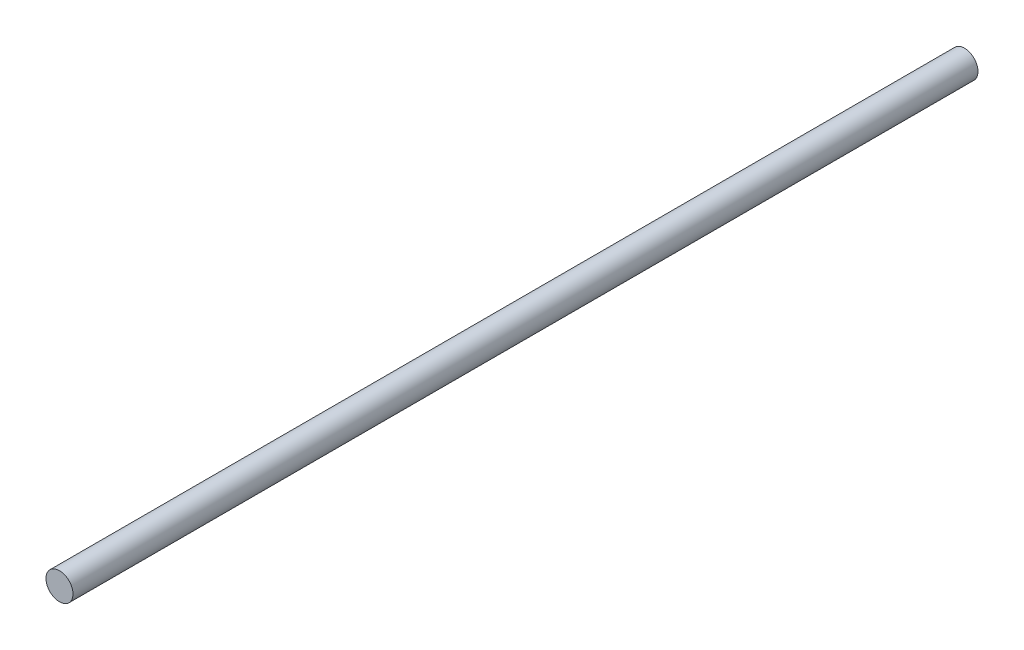
from build123d import *

# Parameters (mm, degrees)
SKETCH1_R           = 4
BOSS_EXTRUDE1_DEPTH = 268


with BuildPart() as part:
    # Sketch1 → Boss-Extrude1 (new body)
    with BuildSketch(Plane.XY):
        Circle(SKETCH1_R)
    extrude(amount=BOSS_EXTRUDE1_DEPTH)


solid = part.part
